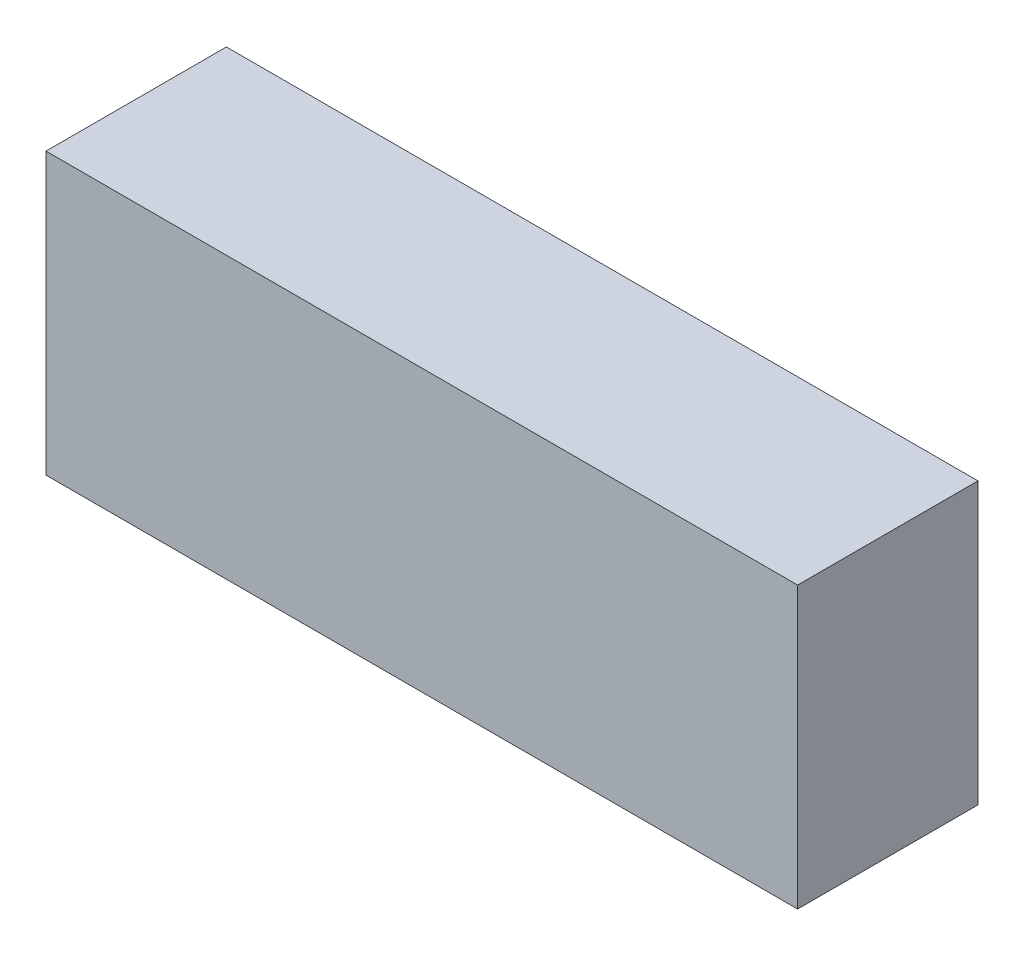
from build123d import *

# Parameters (mm, degrees)
SKETCH1_W           = 75
SKETCH1_H           = 18
BOSS_EXTRUDE1_DEPTH = 28


with BuildPart() as part:
    # Sketch1 → Boss-Extrude1 (new body)
    with BuildSketch(Plane(origin=(0, 0, 0), x_dir=(1, 0, 0), z_dir=(0, 1, 0))):
        Rectangle(SKETCH1_W, SKETCH1_H)
    extrude(amount=BOSS_EXTRUDE1_DEPTH)


solid = part.part
